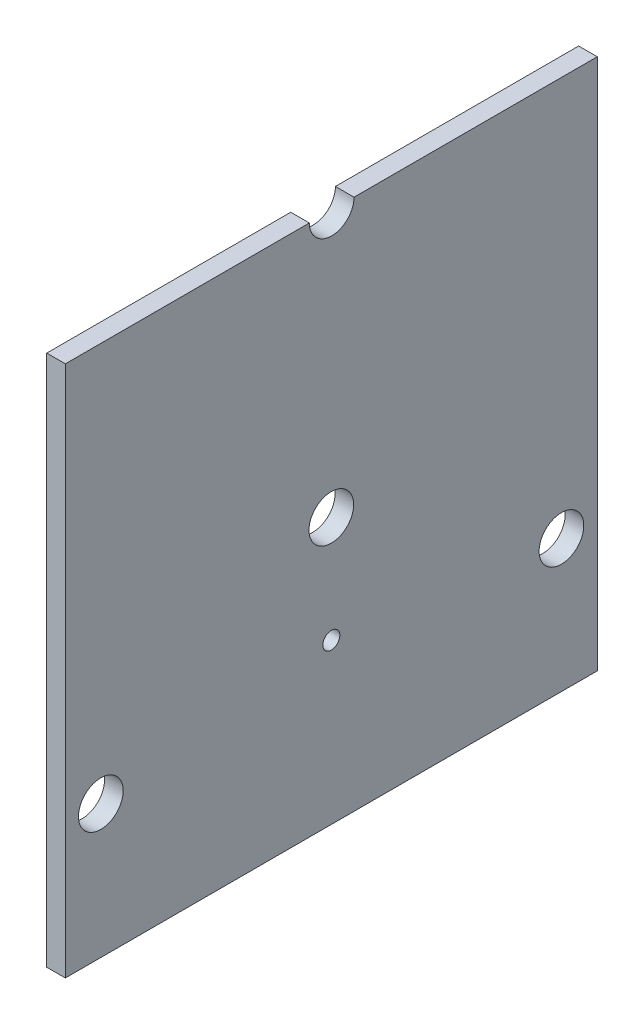
from build123d import *

# Parameters (mm, degrees)
SKETCH2_W           = 100
SKETCH2_H           = 100
SKETCH2_R           = 4.2
BOSS_EXTRUDE1_DEPTH = 3.5
SKETCH3_R           = 4.2
CUT_EXTRUDE1_DEPTH  = 71.797245709
SKETCH4_R           = 1.6
CUT_EXTRUDE2_DEPTH  = 71.797245709


with BuildPart() as part:
    # Sketch2 → Boss-Extrude1 (new body)
    with BuildSketch(Plane(origin=(0, 0, 0), x_dir=(0, 0, -1), z_dir=(1, 0, 0))):
        Rectangle(SKETCH2_W, SKETCH2_H)
        Circle(SKETCH2_R, mode=Mode.SUBTRACT)
    extrude(amount=BOSS_EXTRUDE1_DEPTH)

    # Sketch3 → Cut-Extrude1 (cut, through all)
    with BuildSketch(Plane.ZY):
        with Locations((43.336976945, -24.938051834)):
            Circle(SKETCH3_R)
        with Locations((-43.265474881, -25.061897041)):
            Circle(SKETCH3_R)
        with Locations((-0.071502064, 49.999948875)):
            Circle(SKETCH3_R)
    extrude(amount=-CUT_EXTRUDE1_DEPTH, mode=Mode.SUBTRACT)

    # Sketch4 → Cut-Extrude2 (cut, through all)
    with BuildSketch(Plane.ZY):
        with Locations((0, -20)):
            Circle(SKETCH4_R)
    extrude(amount=-CUT_EXTRUDE2_DEPTH, mode=Mode.SUBTRACT)


solid = part.part
